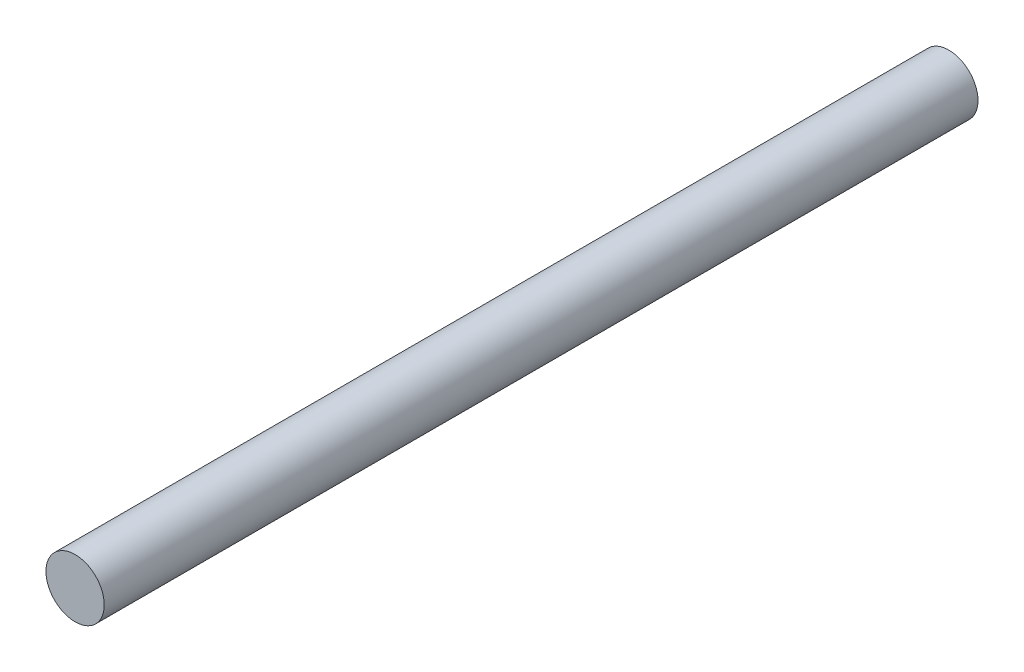
from build123d import *

# Parameters (mm, degrees)
BOSS_EXTRUDE1_DEPTH      = 203.2
BOSS_EXTRUDE1_DEPTH_BACK = 63.2
SKETCH1_R                = 8.89


with BuildPart() as part:
    # Sketch1 → Boss-Extrude1 (new, two sides: drawn at the far end of the back side and taken through both)
    with BuildSketch(Plane.XY.offset(-BOSS_EXTRUDE1_DEPTH_BACK)):
        Circle(SKETCH1_R)
    extrude(amount=BOSS_EXTRUDE1_DEPTH + BOSS_EXTRUDE1_DEPTH_BACK)


solid = part.part
